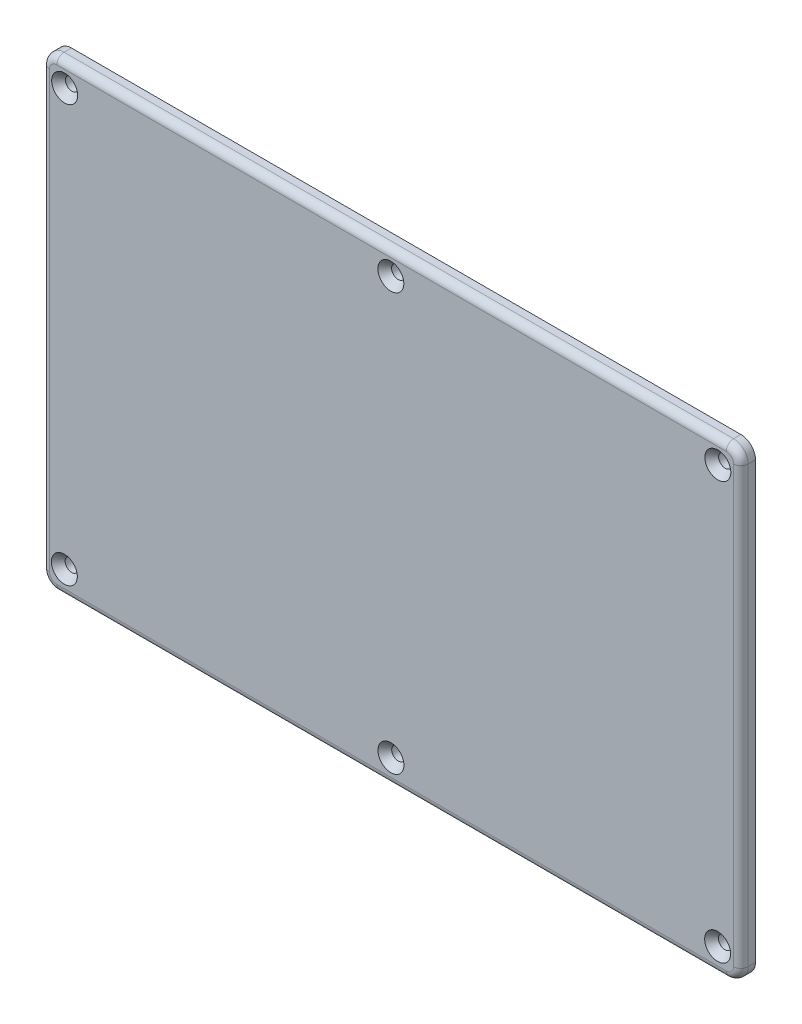
from build123d import *

# Parameters (mm, degrees)
SKETCH3_W           = 191
SKETCH3_H           = 127
BOSS_EXTRUDE3_DEPTH = 4
SKETCH6_R           = 4
BOSS_EXTRUDE4_DEPTH = 0.001
HOLE1_D             = 3.6
HOLE1_DEPTH         = 5
HOLE1_CSINK_D       = 7.1
HOLE1_CSINK_ANGLE   = 82
FILLET1_R           = 4
FILLET2_R           = 2


with BuildPart() as part:
    # Sketch3 → Boss-Extrude3 (new body)
    with BuildSketch(Plane.XY):
        Rectangle(SKETCH3_W, SKETCH3_H)
    extrude(amount=BOSS_EXTRUDE3_DEPTH)

    # Sketch6 → Boss-Extrude4 (add)
    with BuildSketch(Plane.XY):
        with Locations((-89.294075307, 57.128381867)):
            Circle(SKETCH6_R)
        with Locations((89.301830171, 57.128381867)):
            Circle(SKETCH6_R)
        with Locations((89.301830171, -56.852590264)):
            Circle(SKETCH6_R)
        with Locations((-89.294075307, -56.852590264)):
            Circle(SKETCH6_R)
        with Locations((0, -56.852590264)):
            Circle(SKETCH6_R)
        with Locations((0, 57.128381867)):
            Circle(SKETCH6_R)
    extrude(amount=BOSS_EXTRUDE4_DEPTH)

    # Hole1
    with Locations(Plane(origin=(-89.358562902, 57.095579806, 4), x_dir=(1, 0, 0), z_dir=(0, 0, 1))):
        with Locations((0, 0), (89.166832603, 0.030108388), (178.563780061, 0.049936098), (178.506385813, -113.977594328), (89.197749936, -113.952124174), (-0.085769967, -113.957972021)):
            CounterSinkHole(HOLE1_D / 2, HOLE1_CSINK_D / 2, depth=HOLE1_DEPTH, counter_sink_angle=HOLE1_CSINK_ANGLE)

    # Fillet1
    fillet1_edges = [part.edges().sort_by_distance(p)[0] for p in [
        (95.5, -63.5, 2),
        (-95.5, -63.5, 2),
        (-95.5, 63.5, 2),
        (95.5, 63.5, 2),
    ]]
    fillet(fillet1_edges, radius=FILLET1_R)

    # Fillet2
    fillet2_edges = [part.edges().sort_by_distance(p)[0] for p in [
        (-95.5, 0, 4),
        (0, 63.5, 4),
        (95.5, 0, 4),
        (0, -63.5, 4),
        (94.328427125, -62.328427125, 4),
        (94.328427125, 62.328427125, 4),
        (-94.328427125, -62.328427125, 4),
        (-94.328427125, 62.328427125, 4),
    ]]
    fillet(fillet2_edges, radius=FILLET2_R)


solid = part.part
